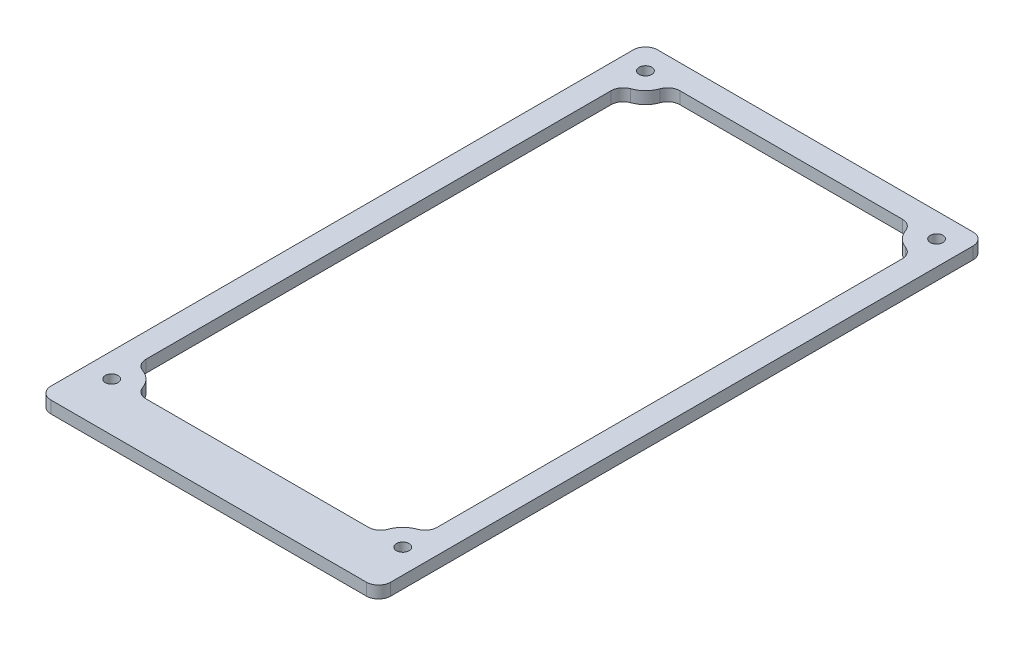
from build123d import *

# Parameters (mm, degrees)
SKETCH1_W               = 177.8
SKETCH1_H               = 317.5
BASE_DEPTH              = 6.35
HOLES_DEPTH             = 183.057944073
HOLES_DEPTH_BACK        = 183.057944073
SKETCH3_R               = 3.302
INNER_CUTOUT_DEPTH      = 183.057944073
INNER_CUTOUT_DEPTH_BACK = 183.057944073
FILLET1_R               = 6.35


with BuildPart() as part:
    # Sketch1 → Base (new body)
    with BuildSketch(Plane(origin=(0, 0, 0), x_dir=(1, 0, 0), z_dir=(0, 1, 0))):
        Rectangle(SKETCH1_W, SKETCH1_H)
    extrude(amount=BASE_DEPTH)

    # Sketch3 → Holes (cut, two sides: drawn at the far end of the back side and taken through both)
    with BuildSketch(Plane.XZ.offset(-HOLES_DEPTH_BACK)):
        with Locations(Location((-76.2, -146.05, 0), (0, 0, 270))):
            Circle(SKETCH3_R)
        with Locations(Location((76.2, -146.05, 0), (0, 0, 270))):
            Circle(SKETCH3_R)
        with Locations(Location((76.2, 133.35, 0), (0, 0, 270))):
            Circle(SKETCH3_R)
        with Locations(Location((-76.2, 133.35, 0), (0, 0, 270))):
            Circle(SKETCH3_R)
    extrude(amount=HOLES_DEPTH + HOLES_DEPTH_BACK, mode=Mode.SUBTRACT)

    # Sketch6 → Inner Cutout (cut, two sides: drawn at the far end of the back side and taken through both)
    with BuildSketch(Plane.XZ.offset(-INNER_CUTOUT_DEPTH_BACK)):
        with BuildLine():
            Line((-76.2, 120.65), (-76.2, -133.35))
            ThreePointArc((-76.2, -133.35), (-67.219743879, -137.069743879), (-63.5, -146.05))
            Line((-63.5, -146.05), (63.5, -146.05))
            ThreePointArc((63.5, -146.05), (67.219743879, -137.069743879), (76.2, -133.35))
            Line((76.2, -133.35), (76.2, 120.65))
            ThreePointArc((76.2, 120.65), (67.219743879, 124.369743879), (63.5, 133.35))
            Line((63.5, 133.35), (-63.5, 133.35))
            ThreePointArc((-63.5, 133.35), (-67.219743879, 124.369743879), (-76.2, 120.65))
        make_face()
    extrude(amount=INNER_CUTOUT_DEPTH + INNER_CUTOUT_DEPTH_BACK, mode=Mode.SUBTRACT)

    # Fillet1
    fillet1_edges = [part.edges().sort_by_distance(p)[0] for p in [
        (-76.2, 3.175, 120.65),
        (-63.5, 3.175, 133.35),
        (63.5, 3.175, 133.35),
        (76.2, 3.175, 120.65),
        (76.2, 3.175, -133.35),
        (63.5, 3.175, -146.05),
        (-63.5, 3.175, -146.05),
        (-76.2, 3.175, -133.35),
        (88.9, 3.175, 158.75),
        (-88.9, 3.175, 158.75),
        (-88.9, 3.175, -158.75),
        (88.9, 3.175, -158.75),
    ]]
    fillet(fillet1_edges, radius=FILLET1_R)


solid = part.part
